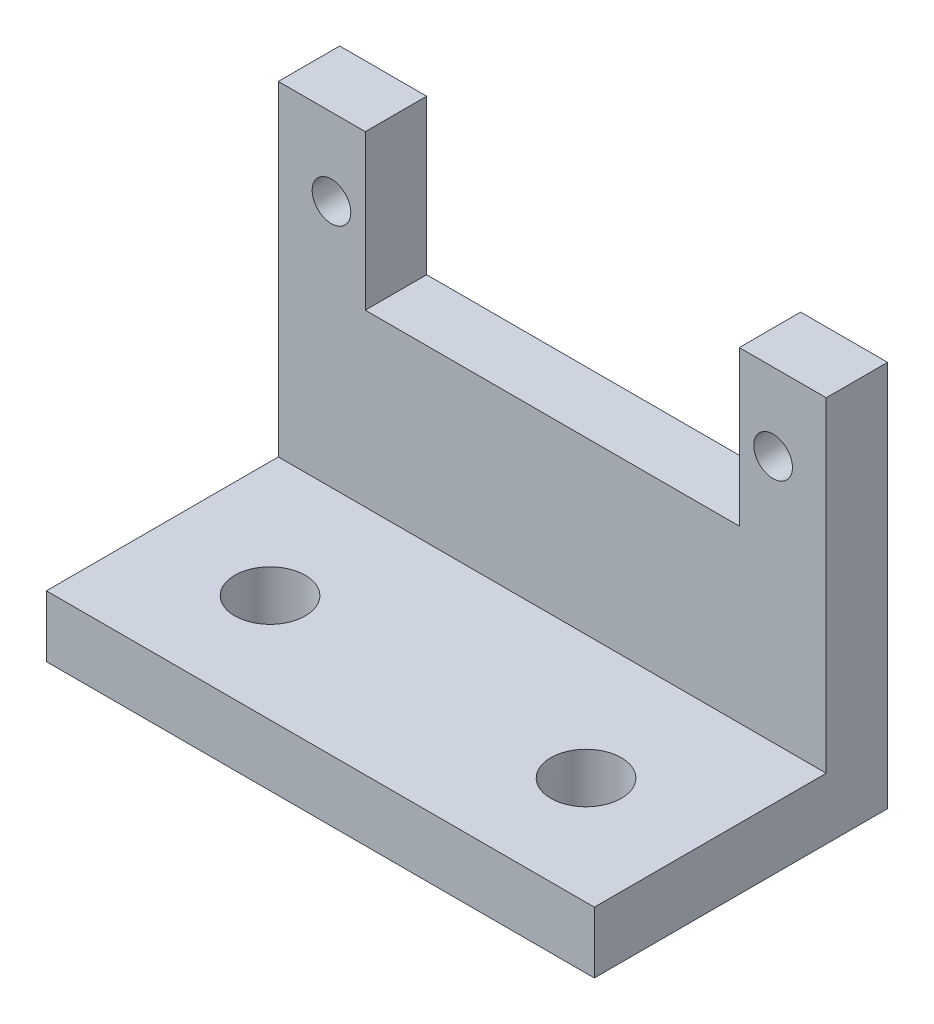
from build123d import *

# Parameters (mm, degrees)
SKETCH1_R           = 1
BOSS_EXTRUDE1_DEPTH = 3.175
SKETCH2_W           = 28.35
SKETCH2_H           = 3.175
BOSS_EXTRUDE2_DEPTH = 12
SKETCH3_R           = 1.825
CUT_EXTRUDE1_DEPTH  = 3.175


with BuildPart() as part:
    # Sketch1 → Boss-Extrude1 (new body)
    with BuildSketch(Plane.XY):
        Polygon((0, 8), (0, 0), (0, -12), (28.35, -12), (28.35, 8), (23.85, 8), (23.85, 0), (4.5, 0), (4.5, 8), align=None)
        with Locations((2.75, 4)):
            Circle(SKETCH1_R, mode=Mode.SUBTRACT)
        with Locations((25.6, 4)):
            Circle(SKETCH1_R, mode=Mode.SUBTRACT)
    extrude(amount=BOSS_EXTRUDE1_DEPTH)

    # Sketch2 → Boss-Extrude2 (add)
    with BuildSketch(Plane.XY.offset(3.175)):
        with Locations((14.175, -10.4125)):
            Rectangle(SKETCH2_W, SKETCH2_H)
    extrude(amount=BOSS_EXTRUDE2_DEPTH)

    # Sketch3 → Cut-Extrude1 (cut)
    with BuildSketch(Plane(origin=(0, -8.825, 0), x_dir=(1, 0, 0), z_dir=(0, 1, 0))):
        with Locations(Location((6, -9.60325543, 0), (0, 0, 270))):
            Circle(SKETCH3_R)
        with Locations(Location((22.35, -9.60325543, 0), (0, 0, 270))):
            Circle(SKETCH3_R)
    extrude(amount=-CUT_EXTRUDE1_DEPTH, mode=Mode.SUBTRACT)


solid = part.part
